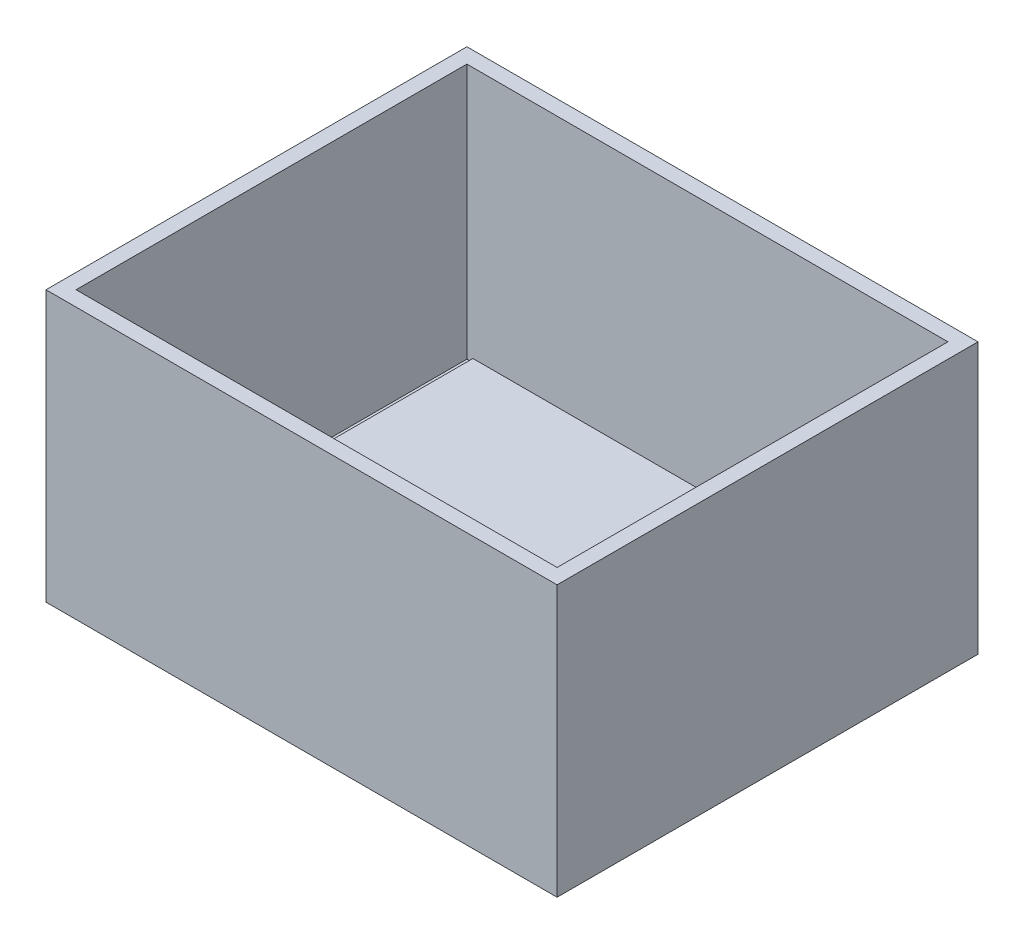
from build123d import *

# Parameters (mm, degrees)
ENCLOSURE_START   = 165
SKETCH1_W         = 70
SKETCH1_H         = 45
ENCLOSURE_DEPTH   = 85
CAVITY_START      = 167.5
SKETCH2_W         = 65
SKETCH2_H         = 47.5
CAVITY_DEPTH      = 80
ARDUINO_UNO_START = 173
SKETCH3_W         = 53.4
SKETCH3_H         = 1.6
ARDUINO_UNO_DEPTH = 68.6


with BuildPart() as part:
    # Sketch1 → enclosure (new body)
    with BuildSketch(Plane(origin=(0, 0, 0), x_dir=(0, 0, -1), z_dir=(1, 0, 0)).offset(ENCLOSURE_START)):
        with Locations((-80, 22.5)):
            Rectangle(SKETCH1_W, SKETCH1_H)
    extrude(amount=ENCLOSURE_DEPTH)


with BuildPart() as body_2:
    # Sketch2 → cavity (new body)
    with BuildSketch(Plane(origin=(0, 0, 0), x_dir=(0, 0, -1), z_dir=(1, 0, 0)).offset(CAVITY_START)):
        with Locations((-80, 26.25)):
            Rectangle(SKETCH2_W, SKETCH2_H)
    extrude(amount=CAVITY_DEPTH)


with BuildPart() as part_1:
    add(part.part)

    # Combine1: cut body 2
    add(body_2.part, mode=Mode.SUBTRACT)


with BuildPart() as body_2_2:
    # Sketch3 → arduino_uno (new body)
    with BuildSketch(Plane(origin=(0, 0, 0), x_dir=(0, 0, -1), z_dir=(1, 0, 0)).offset(ARDUINO_UNO_START)):
        with Locations((-78.7, 6.8)):
            Rectangle(SKETCH3_W, SKETCH3_H)
    extrude(amount=ARDUINO_UNO_DEPTH)


solid = Compound([part_1.part, body_2_2.part])
